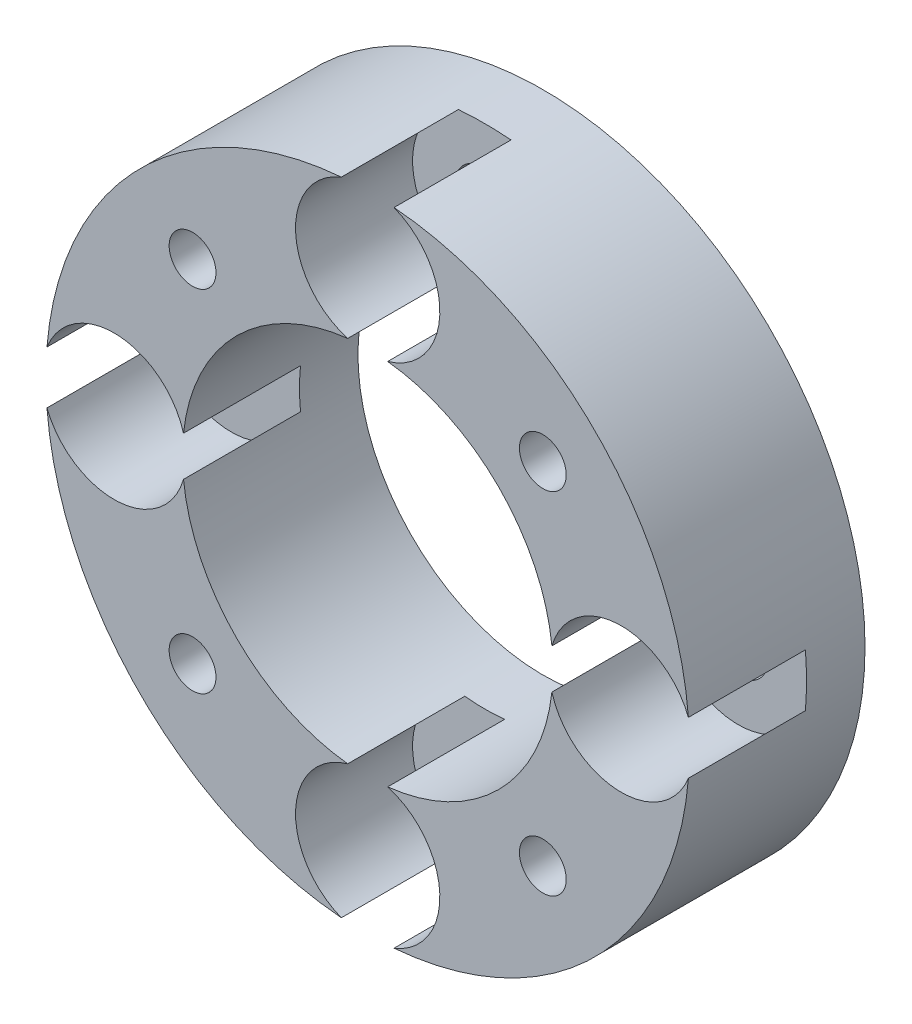
from build123d import *

# Parameters (mm, degrees)
SKETCH1_R           = 16.5
SKETCH1_R_2         = 1.2
SKETCH1_R_3         = 9.5
SKETCH1_R_4         = 1.55
BOSS_EXTRUDE1_DEPTH = 9
SKETCH2_R           = 3.7
CUT_EXTRUDE1_DEPTH  = 6


with BuildPart() as part:
    # Sketch1 → Boss-Extrude1 (new body)
    with BuildSketch(Plane.XY):
        Circle(SKETCH1_R)
        with Locations((8.980256121, 8.980256121)):
            Circle(SKETCH1_R_2, mode=Mode.SUBTRACT)
        with Locations((8.980256121, -8.980256121)):
            Circle(SKETCH1_R_2, mode=Mode.SUBTRACT)
        with Locations((-8.980256121, -8.980256121)):
            Circle(SKETCH1_R_2, mode=Mode.SUBTRACT)
        with Locations((-8.980256121, 8.980256121)):
            Circle(SKETCH1_R_2, mode=Mode.SUBTRACT)
        Circle(SKETCH1_R_3, mode=Mode.SUBTRACT)
        with Locations((0, 13)):
            Circle(SKETCH1_R_4, mode=Mode.SUBTRACT)
        with Locations((13, 0)):
            Circle(SKETCH1_R_4, mode=Mode.SUBTRACT)
        with Locations((0, -13)):
            Circle(SKETCH1_R_4, mode=Mode.SUBTRACT)
        with Locations((-13, 0)):
            Circle(SKETCH1_R_4, mode=Mode.SUBTRACT)
    extrude(amount=BOSS_EXTRUDE1_DEPTH)

    # Sketch2 → Cut-Extrude1 (cut)
    with BuildSketch(Plane.XY.offset(9)):
        with Locations((0, 13)):
            Circle(SKETCH2_R)
        with Locations((13, 0)):
            Circle(SKETCH2_R)
        with Locations((0, -13)):
            Circle(SKETCH2_R)
        with Locations((-13, 0)):
            Circle(SKETCH2_R)
    extrude(amount=-CUT_EXTRUDE1_DEPTH, mode=Mode.SUBTRACT)


solid = part.part
